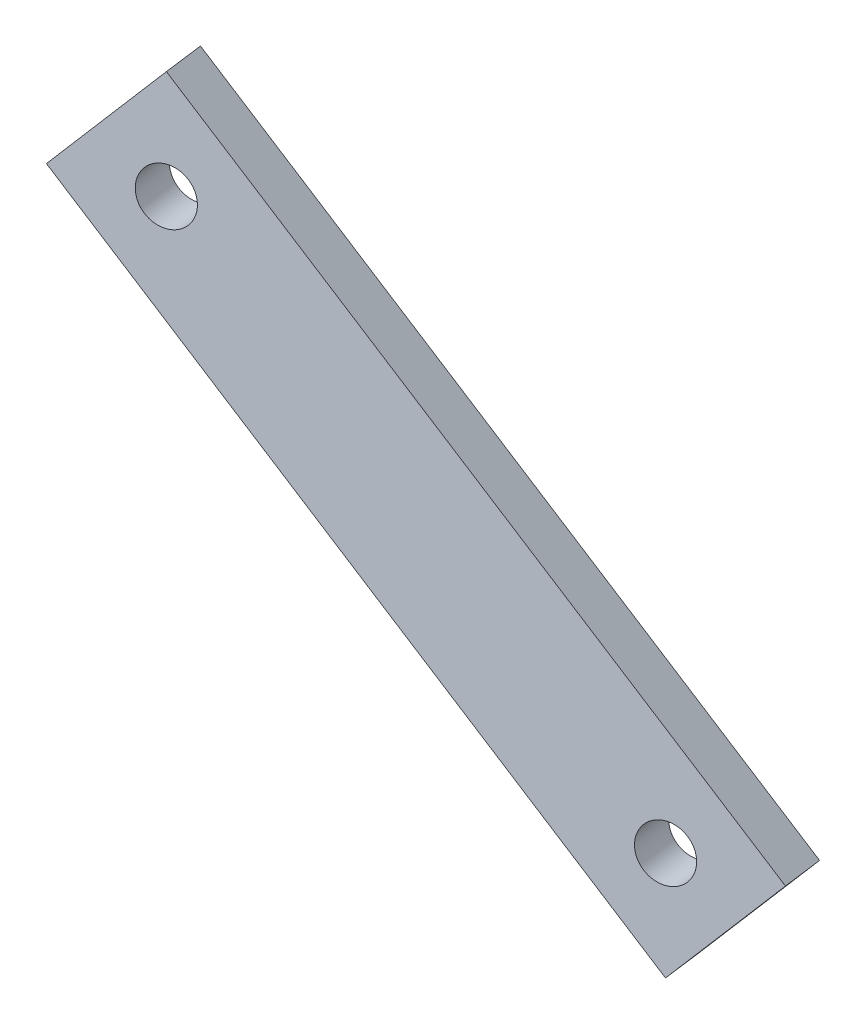
from build123d import *

# Parameters (mm, degrees)
SZKIC3_R                    = 1.10000034
DODANIE_WYCI_GNI_CIE2_DEPTH = 2


with BuildPart() as part:
    # Szkic3 → Dodanie-wyciągnięcie2 (new body)
    with BuildSketch(Plane(origin=(38.160641903, 20.207828477, 157.30929901), x_dir=(0.972253346903095, -0.029805597670841302, -0.23202382589556209), z_dir=(0.23393039442477367, 0.12387698555880203, 0.964329333274237))):
        Polygon((-69.666310572, -102.553561212), (-79.264860968, -94.782442078), (-80.819178513, -93.5240451), (-77.043735552, -88.860781173), (-75.489418007, -90.119178151), (-65.890867611, -97.890297285), (-52.950125678, -108.367300905), (-56.725568639, -113.030564831), align=None)
        with Locations(Location((-57.169345947, -108.811046896, 0), (0, 0, 1.721249632))):
            Circle(SZKIC3_R, mode=Mode.SUBTRACT)
        with Locations(Location((-76.599691895, -93.079970126, 0), (0, 0, 1.721249632))):
            Circle(SZKIC3_R, mode=Mode.SUBTRACT)
    extrude(amount=DODANIE_WYCI_GNI_CIE2_DEPTH)


solid = part.part
